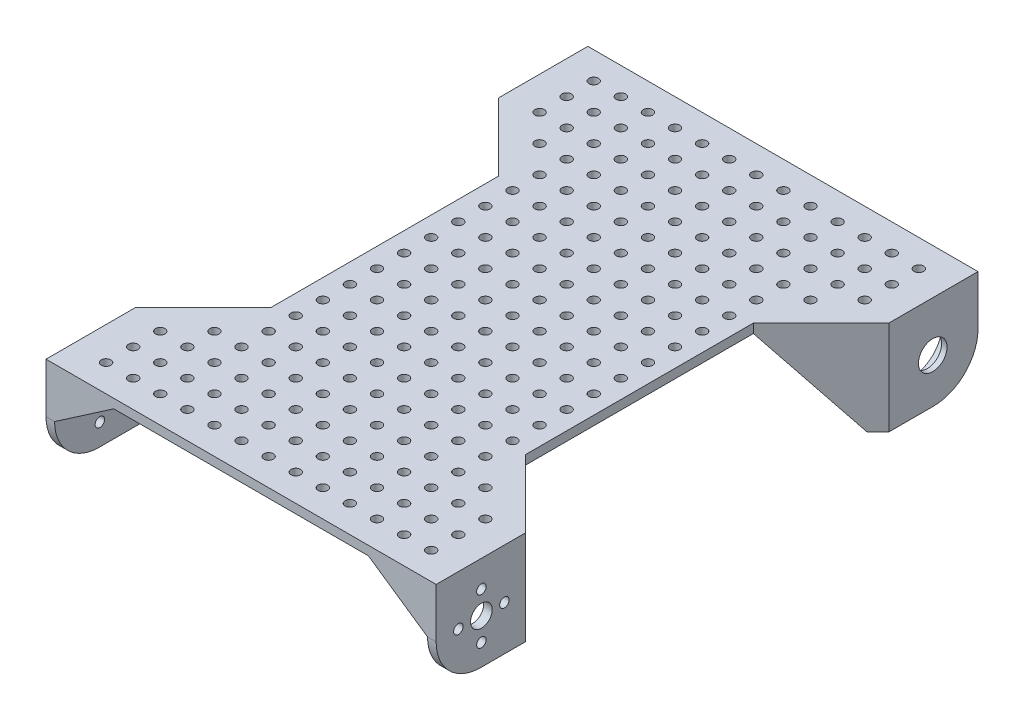
from build123d import *

# Parameters (mm, degrees)
CROQUIS1_R              = 1.75
CROQUIS1_R_2            = 4
CROQUIS1_R_3            = 5.275
SALIENTE_EXTRUIR1_DEPTH = 2
CROQUIS2_W              = 200
CROQUIS2_H              = 3.36816026
SALIENTE_EXTRUIR2_DEPTH = 70
CORTAR_EXTRUIR1_DEPTH   = 128.173513359
CROQUIS5_R              = 1.75
CROQUIS5_R_2            = 4
SALIENTE_EXTRUIR3_DEPTH = 1.175
CROQUIS6_R              = 11.25
SALIENTE_EXTRUIR4_DEPTH = 6.05
SALIENTE_EXTRUIR5_START = -3.175
SALIENTE_EXTRUIR5_DEPTH = 3.175
SALIENTE_EXTRUIR6_DEPTH = 4.875
SALIENTE_EXTRUIR7_DEPTH = 31.45
CORTAR_EXTRUIR2_DEPTH   = 147.040623629
CORTAR_EXTRUIR3_DEPTH   = 144.56214791
CROQUIS13_W             = 3
CROQUIS13_H             = 15
SALIENTE_EXTRUIR8_DEPTH = 21.825
CORTAR_EXTRUIR4_DEPTH   = 3
CORTAR_EXTRUIR5_DEPTH   = 3
CROQUIS16_R             = 1.75
CORTAR_EXTRUIR6_DEPTH   = 179.115419041


with BuildPart() as part:
    # Croquis1 → Saliente-Extruir1 (new body)
    with BuildSketch(Plane(origin=(0, 0, 0), x_dir=(0, 0, -1), z_dir=(1, 0, 0))):
        with BuildLine():
            Line((-67.1, 0), (67.1, 0))
            Line((67.1, 0), (67.1, -15))
            ThreePointArc((67.1, -15), (83.55, -31.45), (100, -15))
            Line((100, -15), (100, 0))
            Line((100, 0), (100, 3.36816026))
            Line((100, 3.36816026), (-100, 3.36816026))
            Line((-100, 3.36816026), (-100, 0))
            Line((-100, 0), (-100, -15))
            ThreePointArc((-100, -15), (-83.55, -31.45), (-67.1, -15))
            Line((-67.1, -15), (-67.1, 0))
        make_face()
        with Locations((-83.3, -23.5)):
            Circle(CROQUIS1_R, mode=Mode.SUBTRACT)
        with Locations((-91.8, -15)):
            Circle(CROQUIS1_R, mode=Mode.SUBTRACT)
        with Locations((-74.8, -15)):
            Circle(CROQUIS1_R, mode=Mode.SUBTRACT)
        with Locations((-83.3, -6.5)):
            Circle(CROQUIS1_R, mode=Mode.SUBTRACT)
        with Locations((-83.3, -15)):
            Circle(CROQUIS1_R_2, mode=Mode.SUBTRACT)
        with Locations((83.3, -15)):
            Circle(CROQUIS1_R_3, mode=Mode.SUBTRACT)
    extrude(amount=SALIENTE_EXTRUIR1_DEPTH)

    # Croquis2 → Saliente-Extruir2 (add)
    with BuildSketch(Plane(origin=(2, 0, 0), x_dir=(0, 0, -1), z_dir=(1, 0, 0))):
        with Locations((0, 1.68408013)):
            Rectangle(CROQUIS2_W, CROQUIS2_H)
    extrude(amount=SALIENTE_EXTRUIR2_DEPTH)

    # Croquis3 → Cortar-Extruir1 (cut, through all)
    with BuildSketch(Plane.XZ):
        Polygon((0, 67.1), (25, 42.1), (25, -42.1), (0, -67.1), align=None)
    extrude(amount=-CORTAR_EXTRUIR1_DEPTH, mode=Mode.SUBTRACT)

    # Croquis5 → Saliente-Extruir3 (add)
    with BuildSketch(Plane(origin=(2, 0, 0), x_dir=(0, 0, -1), z_dir=(1, 0, 0))):
        with BuildLine():
            Line((-67.1, 0), (-100, 0))
            Line((-100, 0), (-100, -15))
            ThreePointArc((-100, -15), (-83.55, -31.45), (-67.1, -15))
            Line((-67.1, -15), (-67.1, 0))
        make_face()
        with Locations((-83.3, -23.5)):
            Circle(CROQUIS5_R, mode=Mode.SUBTRACT)
        with Locations((-91.8, -15)):
            Circle(CROQUIS5_R, mode=Mode.SUBTRACT)
        with Locations((-74.8, -15)):
            Circle(CROQUIS5_R, mode=Mode.SUBTRACT)
        with Locations((-83.3, -6.5)):
            Circle(CROQUIS5_R, mode=Mode.SUBTRACT)
        with Locations((-83.3, -15)):
            Circle(CROQUIS5_R_2, mode=Mode.SUBTRACT)
    extrude(amount=SALIENTE_EXTRUIR3_DEPTH)

    # Croquis6 → Saliente-Extruir4 (add)
    with BuildSketch(Plane(origin=(2, 0, 0), x_dir=(0, 0, -1), z_dir=(1, 0, 0))):
        with BuildLine():
            Line((100, 0), (67.1, 0))
            Line((67.1, 0), (67.1, -15))
            ThreePointArc((67.1, -15), (83.55, -31.45), (100, -15))
            Line((100, -15), (100, 0))
        make_face()
        with Locations((83.55, -15)):
            Circle(CROQUIS6_R, mode=Mode.SUBTRACT)
    extrude(amount=SALIENTE_EXTRUIR4_DEPTH)

    # Croquis8 → Saliente-Extruir5 (add)
    with BuildSketch(Plane(origin=(3.175, 0, 0), x_dir=(0, 0, -1), z_dir=(1, 0, 0)).offset(SALIENTE_EXTRUIR5_START)):
        with BuildLine():
            Line((-83.55, -31.45), (-67.1, -31.45))
            Line((-67.1, -31.45), (-67.1, -15))
            ThreePointArc((-67.1, -15), (-71.918093449, -26.631906551), (-83.55, -31.45))
        make_face()
        with BuildLine():
            Line((83.55, -31.45), (67.1, -31.45))
            Line((67.1, -31.45), (67.1, -15))
            ThreePointArc((67.1, -15), (71.918093449, -26.631906551), (83.55, -31.45))
        make_face()
    extrude(amount=SALIENTE_EXTRUIR5_DEPTH)

    # Croquis10 → Saliente-Extruir6 (add)
    with BuildSketch(Plane(origin=(3.175, 0, 0), x_dir=(0, 0, -1), z_dir=(1, 0, 0))):
        with BuildLine():
            Line((67.1, -15), (67.1, -31.45))
            Line((67.1, -31.45), (83.55, -31.45))
            ThreePointArc((83.55, -31.45), (71.918093449, -26.631906551), (67.1, -15))
        make_face()
    extrude(amount=SALIENTE_EXTRUIR6_DEPTH)

    # Croquis9 → Saliente-Extruir7 (add)
    with BuildSketch(Plane.XZ):
        Polygon((25, 42.1), (25, 45.275), (3.175, 67.1), (0, 67.1), align=None)
        Polygon((25, -50.15), (8.05, -67.1), (0, -67.1), (25, -42.1), align=None)
    extrude(amount=SALIENTE_EXTRUIR7_DEPTH)

    # Croquis11 → Cortar-Extruir2 (cut, through all)
    with BuildSketch(Plane(origin=(37.575, 0, -37.575), x_dir=(-0.7071067811865475, 0, -0.7071067811865477), z_dir=(0.7071067811865477, 0, -0.7071067811865475))):
        Polygon((41.754655429, -31.45), (12.091525958, 0), (12.091525958, -31.45), align=None)
    extrude(amount=-CORTAR_EXTRUIR2_DEPTH, mode=Mode.SUBTRACT)

    # Croquis12 → Cortar-Extruir3 (cut, through all)
    with BuildSketch(Plane(origin=(35.1375, 0, 35.1375), x_dir=(0.7071067811865475, 0, -0.7071067811865477), z_dir=(0.7071067811865477, 0, 0.7071067811865475))):
        Polygon((-45.201800987, -31.45), (-12.091525958, 0), (-12.091525958, -31.45), align=None)
    extrude(amount=-CORTAR_EXTRUIR3_DEPTH, mode=Mode.SUBTRACT)

    # Croquis13 → Saliente-Extruir8 (add)
    with BuildSketch(Plane(origin=(3.175, 0, 0), x_dir=(0, 0, -1), z_dir=(1, 0, 0))):
        with Locations((-98.5, -7.5)):
            Rectangle(CROQUIS13_W, CROQUIS13_H)
        with Locations((98.5, -7.5)):
            Rectangle(CROQUIS13_W, CROQUIS13_H)
    extrude(amount=SALIENTE_EXTRUIR8_DEPTH)

    # Croquis14 → Cortar-Extruir4 (cut)
    with BuildSketch(Plane.XY.offset(100)):
        Polygon((3.175, -15), (25, 0), (25, -15), align=None)
    extrude(amount=-CORTAR_EXTRUIR4_DEPTH, mode=Mode.SUBTRACT)

    # Croquis15 → Cortar-Extruir5 (cut)
    with BuildSketch(Plane(origin=(0, 0, -100), x_dir=(-1, 0, 0), z_dir=(0, 0, -1))):
        Polygon((-8.05, -15), (-25, 0), (-25, -15), align=None)
    extrude(amount=-CORTAR_EXTRUIR5_DEPTH, mode=Mode.SUBTRACT)

    # Simetría1: part across plane


with BuildPart() as part_1:
    add(part.part)
    add(part.part.mirror(Plane(origin=(72, 0, 0), x_dir=(0, 0, 1), z_dir=(1, 0, 0))))

    # Croquis16 → Cortar-Extruir6 (cut, through all)
    with BuildSketch(Plane.XZ):
        with Locations(Location((12.175, 90, 0), (0, 0, 270))):
            Circle(CROQUIS16_R)
        with Locations(Location((22.175, 90, 0), (0, 0, 270))):
            Circle(CROQUIS16_R)
        with Locations(Location((32.175, 90, 0), (0, 0, 270))):
            Circle(CROQUIS16_R)
        with Locations(Location((42.175, 90, 0), (0, 0, 270))):
            Circle(CROQUIS16_R)
        with Locations(Location((52.175, 90, 0), (0, 0, 270))):
            Circle(CROQUIS16_R)
        with Locations(Location((62.175, 90, 0), (0, 0, 270))):
            Circle(CROQUIS16_R)
        with Locations(Location((72.175, 90, 0), (0, 0, 270))):
            Circle(CROQUIS16_R)
        with Locations(Location((82.175, 90, 0), (0, 0, 270))):
            Circle(CROQUIS16_R)
        with Locations(Location((92.175, 90, 0), (0, 0, 270))):
            Circle(CROQUIS16_R)
        with Locations(Location((102.175, 90, 0), (0, 0, 270))):
            Circle(CROQUIS16_R)
        with Locations(Location((112.175, 90, 0), (0, 0, 270))):
            Circle(CROQUIS16_R)
        with Locations(Location((122.175, 90, 0), (0, 0, 270))):
            Circle(CROQUIS16_R)
        with Locations(Location((132.175, 90, 0), (0, 0, 270))):
            Circle(CROQUIS16_R)
        with Locations(Location((22.175, 80, 0), (0, 0, 270))):
            Circle(CROQUIS16_R)
        with Locations(Location((32.175, 80, 0), (0, 0, 270))):
            Circle(CROQUIS16_R)
        with Locations(Location((42.175, 80, 0), (0, 0, 270))):
            Circle(CROQUIS16_R)
        with Locations(Location((52.175, 80, 0), (0, 0, 270))):
            Circle(CROQUIS16_R)
        with Locations(Location((62.175, 80, 0), (0, 0, 270))):
            Circle(CROQUIS16_R)
        with Locations(Location((72.175, 80, 0), (0, 0, 270))):
            Circle(CROQUIS16_R)
        with Locations(Location((82.175, 80, 0), (0, 0, 270))):
            Circle(CROQUIS16_R)
        with Locations(Location((92.175, 80, 0), (0, 0, 270))):
            Circle(CROQUIS16_R)
        with Locations(Location((102.175, 80, 0), (0, 0, 270))):
            Circle(CROQUIS16_R)
        with Locations(Location((112.175, 80, 0), (0, 0, 270))):
            Circle(CROQUIS16_R)
        with Locations(Location((122.175, 80, 0), (0, 0, 270))):
            Circle(CROQUIS16_R)
        with Locations(Location((132.175, 80, 0), (0, 0, 270))):
            Circle(CROQUIS16_R)
        with Locations(Location((22.175, 70, 0), (0, 0, 270))):
            Circle(CROQUIS16_R)
        with Locations(Location((32.175, 70, 0), (0, 0, 270))):
            Circle(CROQUIS16_R)
        with Locations(Location((42.175, 70, 0), (0, 0, 270))):
            Circle(CROQUIS16_R)
        with Locations(Location((52.175, 70, 0), (0, 0, 270))):
            Circle(CROQUIS16_R)
        with Locations(Location((62.175, 70, 0), (0, 0, 270))):
            Circle(CROQUIS16_R)
        with Locations(Location((72.175, 70, 0), (0, 0, 270))):
            Circle(CROQUIS16_R)
        with Locations(Location((82.175, 70, 0), (0, 0, 270))):
            Circle(CROQUIS16_R)
        with Locations(Location((92.175, 70, 0), (0, 0, 270))):
            Circle(CROQUIS16_R)
        with Locations(Location((102.175, 70, 0), (0, 0, 270))):
            Circle(CROQUIS16_R)
        with Locations(Location((112.175, 70, 0), (0, 0, 270))):
            Circle(CROQUIS16_R)
        with Locations(Location((122.175, 70, 0), (0, 0, 270))):
            Circle(CROQUIS16_R)
        with Locations(Location((132.175, 70, 0), (0, 0, 270))):
            Circle(CROQUIS16_R)
        with Locations(Location((22.175, 60, 0), (0, 0, 270))):
            Circle(CROQUIS16_R)
        with Locations(Location((32.175, 60, 0), (0, 0, 270))):
            Circle(CROQUIS16_R)
        with Locations(Location((42.175, 60, 0), (0, 0, 270))):
            Circle(CROQUIS16_R)
        with Locations(Location((52.175, 60, 0), (0, 0, 270))):
            Circle(CROQUIS16_R)
        with Locations(Location((62.175, 60, 0), (0, 0, 270))):
            Circle(CROQUIS16_R)
        with Locations(Location((72.175, 60, 0), (0, 0, 270))):
            Circle(CROQUIS16_R)
        with Locations(Location((82.175, 60, 0), (0, 0, 270))):
            Circle(CROQUIS16_R)
        with Locations(Location((92.175, 60, 0), (0, 0, 270))):
            Circle(CROQUIS16_R)
        with Locations(Location((102.175, 60, 0), (0, 0, 270))):
            Circle(CROQUIS16_R)
        with Locations(Location((112.175, 60, 0), (0, 0, 270))):
            Circle(CROQUIS16_R)
        with Locations(Location((122.175, 60, 0), (0, 0, 270))):
            Circle(CROQUIS16_R)
        with Locations(Location((32.175, 50, 0), (0, 0, 270))):
            Circle(CROQUIS16_R)
        with Locations(Location((42.175, 50, 0), (0, 0, 270))):
            Circle(CROQUIS16_R)
        with Locations(Location((52.175, 50, 0), (0, 0, 270))):
            Circle(CROQUIS16_R)
        with Locations(Location((62.175, 50, 0), (0, 0, 270))):
            Circle(CROQUIS16_R)
        with Locations(Location((72.175, 50, 0), (0, 0, 270))):
            Circle(CROQUIS16_R)
        with Locations(Location((82.175, 50, 0), (0, 0, 270))):
            Circle(CROQUIS16_R)
        with Locations(Location((92.175, 50, 0), (0, 0, 270))):
            Circle(CROQUIS16_R)
        with Locations(Location((102.175, 50, 0), (0, 0, 270))):
            Circle(CROQUIS16_R)
        with Locations(Location((112.175, 50, 0), (0, 0, 270))):
            Circle(CROQUIS16_R)
        with Locations(Location((32.175, 40, 0), (0, 0, 270))):
            Circle(CROQUIS16_R)
        with Locations(Location((42.175, 40, 0), (0, 0, 270))):
            Circle(CROQUIS16_R)
        with Locations(Location((52.175, 40, 0), (0, 0, 270))):
            Circle(CROQUIS16_R)
        with Locations(Location((62.175, 40, 0), (0, 0, 270))):
            Circle(CROQUIS16_R)
        with Locations(Location((72.175, 40, 0), (0, 0, 270))):
            Circle(CROQUIS16_R)
        with Locations(Location((82.175, 40, 0), (0, 0, 270))):
            Circle(CROQUIS16_R)
        with Locations(Location((92.175, 40, 0), (0, 0, 270))):
            Circle(CROQUIS16_R)
        with Locations(Location((102.175, 40, 0), (0, 0, 270))):
            Circle(CROQUIS16_R)
        with Locations(Location((112.175, 40, 0), (0, 0, 270))):
            Circle(CROQUIS16_R)
        with Locations(Location((32.175, 30, 0), (0, 0, 270))):
            Circle(CROQUIS16_R)
        with Locations(Location((42.175, 30, 0), (0, 0, 270))):
            Circle(CROQUIS16_R)
        with Locations(Location((52.175, 30, 0), (0, 0, 270))):
            Circle(CROQUIS16_R)
        with Locations(Location((62.175, 30, 0), (0, 0, 270))):
            Circle(CROQUIS16_R)
        with Locations(Location((72.175, 30, 0), (0, 0, 270))):
            Circle(CROQUIS16_R)
        with Locations(Location((82.175, 30, 0), (0, 0, 270))):
            Circle(CROQUIS16_R)
        with Locations(Location((92.175, 30, 0), (0, 0, 270))):
            Circle(CROQUIS16_R)
        with Locations(Location((102.175, 30, 0), (0, 0, 270))):
            Circle(CROQUIS16_R)
        with Locations(Location((112.175, 30, 0), (0, 0, 270))):
            Circle(CROQUIS16_R)
        with Locations(Location((32.175, 20, 0), (0, 0, 270))):
            Circle(CROQUIS16_R)
        with Locations(Location((42.175, 20, 0), (0, 0, 270))):
            Circle(CROQUIS16_R)
        with Locations(Location((52.175, 20, 0), (0, 0, 270))):
            Circle(CROQUIS16_R)
        with Locations(Location((62.175, 20, 0), (0, 0, 270))):
            Circle(CROQUIS16_R)
        with Locations(Location((72.175, 20, 0), (0, 0, 270))):
            Circle(CROQUIS16_R)
        with Locations(Location((82.175, 20, 0), (0, 0, 270))):
            Circle(CROQUIS16_R)
        with Locations(Location((92.175, 20, 0), (0, 0, 270))):
            Circle(CROQUIS16_R)
        with Locations(Location((102.175, 20, 0), (0, 0, 270))):
            Circle(CROQUIS16_R)
        with Locations(Location((112.175, 20, 0), (0, 0, 270))):
            Circle(CROQUIS16_R)
        with Locations(Location((32.175, 10, 0), (0, 0, 270))):
            Circle(CROQUIS16_R)
        with Locations(Location((42.175, 10, 0), (0, 0, 270))):
            Circle(CROQUIS16_R)
        with Locations(Location((52.175, 10, 0), (0, 0, 270))):
            Circle(CROQUIS16_R)
        with Locations(Location((62.175, 10, 0), (0, 0, 270))):
            Circle(CROQUIS16_R)
        with Locations(Location((72.175, 10, 0), (0, 0, 270))):
            Circle(CROQUIS16_R)
        with Locations(Location((82.175, 10, 0), (0, 0, 270))):
            Circle(CROQUIS16_R)
        with Locations(Location((92.175, 10, 0), (0, 0, 270))):
            Circle(CROQUIS16_R)
        with Locations(Location((102.175, 10, 0), (0, 0, 270))):
            Circle(CROQUIS16_R)
        with Locations(Location((112.175, 10, 0), (0, 0, 270))):
            Circle(CROQUIS16_R)
        with Locations(Location((32.175, 0, 0), (0, 0, 270))):
            Circle(CROQUIS16_R)
        with Locations(Location((42.175, 0, 0), (0, 0, 270))):
            Circle(CROQUIS16_R)
        with Locations(Location((52.175, 0, 0), (0, 0, 270))):
            Circle(CROQUIS16_R)
        with Locations(Location((62.175, 0, 0), (0, 0, 270))):
            Circle(CROQUIS16_R)
        with Locations(Location((72.175, 0, 0), (0, 0, 270))):
            Circle(CROQUIS16_R)
        with Locations(Location((82.175, 0, 0), (0, 0, 270))):
            Circle(CROQUIS16_R)
        with Locations(Location((92.175, 0, 0), (0, 0, 270))):
            Circle(CROQUIS16_R)
        with Locations(Location((102.175, 0, 0), (0, 0, 270))):
            Circle(CROQUIS16_R)
        with Locations(Location((112.175, 0, 0), (0, 0, 270))):
            Circle(CROQUIS16_R)
        with Locations(Location((32.175, -10, 0), (0, 0, 270))):
            Circle(CROQUIS16_R)
        with Locations(Location((42.175, -10, 0), (0, 0, 270))):
            Circle(CROQUIS16_R)
        with Locations(Location((52.175, -10, 0), (0, 0, 270))):
            Circle(CROQUIS16_R)
        with Locations(Location((62.175, -10, 0), (0, 0, 270))):
            Circle(CROQUIS16_R)
        with Locations(Location((72.175, -10, 0), (0, 0, 270))):
            Circle(CROQUIS16_R)
        with Locations(Location((82.175, -10, 0), (0, 0, 270))):
            Circle(CROQUIS16_R)
        with Locations(Location((92.175, -10, 0), (0, 0, 270))):
            Circle(CROQUIS16_R)
        with Locations(Location((102.175, -10, 0), (0, 0, 270))):
            Circle(CROQUIS16_R)
        with Locations(Location((112.175, -10, 0), (0, 0, 270))):
            Circle(CROQUIS16_R)
        with Locations(Location((32.175, -20, 0), (0, 0, 270))):
            Circle(CROQUIS16_R)
        with Locations(Location((42.175, -20, 0), (0, 0, 270))):
            Circle(CROQUIS16_R)
        with Locations(Location((52.175, -20, 0), (0, 0, 270))):
            Circle(CROQUIS16_R)
        with Locations(Location((62.175, -20, 0), (0, 0, 270))):
            Circle(CROQUIS16_R)
        with Locations(Location((72.175, -20, 0), (0, 0, 270))):
            Circle(CROQUIS16_R)
        with Locations(Location((82.175, -20, 0), (0, 0, 270))):
            Circle(CROQUIS16_R)
        with Locations(Location((92.175, -20, 0), (0, 0, 270))):
            Circle(CROQUIS16_R)
        with Locations(Location((102.175, -20, 0), (0, 0, 270))):
            Circle(CROQUIS16_R)
        with Locations(Location((112.175, -20, 0), (0, 0, 270))):
            Circle(CROQUIS16_R)
        with Locations(Location((32.175, -30, 0), (0, 0, 270))):
            Circle(CROQUIS16_R)
        with Locations(Location((42.175, -30, 0), (0, 0, 270))):
            Circle(CROQUIS16_R)
        with Locations(Location((52.175, -30, 0), (0, 0, 270))):
            Circle(CROQUIS16_R)
        with Locations(Location((62.175, -30, 0), (0, 0, 270))):
            Circle(CROQUIS16_R)
        with Locations(Location((72.175, -30, 0), (0, 0, 270))):
            Circle(CROQUIS16_R)
        with Locations(Location((82.175, -30, 0), (0, 0, 270))):
            Circle(CROQUIS16_R)
        with Locations(Location((92.175, -30, 0), (0, 0, 270))):
            Circle(CROQUIS16_R)
        with Locations(Location((102.175, -30, 0), (0, 0, 270))):
            Circle(CROQUIS16_R)
        with Locations(Location((112.175, -30, 0), (0, 0, 270))):
            Circle(CROQUIS16_R)
        with Locations(Location((32.175, -40, 0), (0, 0, 270))):
            Circle(CROQUIS16_R)
        with Locations(Location((42.175, -40, 0), (0, 0, 270))):
            Circle(CROQUIS16_R)
        with Locations(Location((52.175, -40, 0), (0, 0, 270))):
            Circle(CROQUIS16_R)
        with Locations(Location((62.175, -40, 0), (0, 0, 270))):
            Circle(CROQUIS16_R)
        with Locations(Location((72.175, -40, 0), (0, 0, 270))):
            Circle(CROQUIS16_R)
        with Locations(Location((82.175, -40, 0), (0, 0, 270))):
            Circle(CROQUIS16_R)
        with Locations(Location((92.175, -40, 0), (0, 0, 270))):
            Circle(CROQUIS16_R)
        with Locations(Location((102.175, -40, 0), (0, 0, 270))):
            Circle(CROQUIS16_R)
        with Locations(Location((112.175, -40, 0), (0, 0, 270))):
            Circle(CROQUIS16_R)
        with Locations(Location((32.175, -50, 0), (0, 0, 270))):
            Circle(CROQUIS16_R)
        with Locations(Location((42.175, -50, 0), (0, 0, 270))):
            Circle(CROQUIS16_R)
        with Locations(Location((52.175, -50, 0), (0, 0, 270))):
            Circle(CROQUIS16_R)
        with Locations(Location((62.175, -50, 0), (0, 0, 270))):
            Circle(CROQUIS16_R)
        with Locations(Location((72.175, -50, 0), (0, 0, 270))):
            Circle(CROQUIS16_R)
        with Locations(Location((82.175, -50, 0), (0, 0, 270))):
            Circle(CROQUIS16_R)
        with Locations(Location((92.175, -50, 0), (0, 0, 270))):
            Circle(CROQUIS16_R)
        with Locations(Location((102.175, -50, 0), (0, 0, 270))):
            Circle(CROQUIS16_R)
        with Locations(Location((112.175, -50, 0), (0, 0, 270))):
            Circle(CROQUIS16_R)
        with Locations(Location((22.175, -60, 0), (0, 0, 270))):
            Circle(CROQUIS16_R)
        with Locations(Location((32.175, -60, 0), (0, 0, 270))):
            Circle(CROQUIS16_R)
        with Locations(Location((42.175, -60, 0), (0, 0, 270))):
            Circle(CROQUIS16_R)
        with Locations(Location((52.175, -60, 0), (0, 0, 270))):
            Circle(CROQUIS16_R)
        with Locations(Location((62.175, -60, 0), (0, 0, 270))):
            Circle(CROQUIS16_R)
        with Locations(Location((72.175, -60, 0), (0, 0, 270))):
            Circle(CROQUIS16_R)
        with Locations(Location((82.175, -60, 0), (0, 0, 270))):
            Circle(CROQUIS16_R)
        with Locations(Location((92.175, -60, 0), (0, 0, 270))):
            Circle(CROQUIS16_R)
        with Locations(Location((102.175, -60, 0), (0, 0, 270))):
            Circle(CROQUIS16_R)
        with Locations(Location((112.175, -60, 0), (0, 0, 270))):
            Circle(CROQUIS16_R)
        with Locations(Location((122.175, -60, 0), (0, 0, 270))):
            Circle(CROQUIS16_R)
        with Locations(Location((22.175, -70, 0), (0, 0, 270))):
            Circle(CROQUIS16_R)
        with Locations(Location((32.175, -70, 0), (0, 0, 270))):
            Circle(CROQUIS16_R)
        with Locations(Location((42.175, -70, 0), (0, 0, 270))):
            Circle(CROQUIS16_R)
        with Locations(Location((52.175, -70, 0), (0, 0, 270))):
            Circle(CROQUIS16_R)
        with Locations(Location((62.175, -70, 0), (0, 0, 270))):
            Circle(CROQUIS16_R)
        with Locations(Location((72.175, -70, 0), (0, 0, 270))):
            Circle(CROQUIS16_R)
        with Locations(Location((82.175, -70, 0), (0, 0, 270))):
            Circle(CROQUIS16_R)
        with Locations(Location((92.175, -70, 0), (0, 0, 270))):
            Circle(CROQUIS16_R)
        with Locations(Location((102.175, -70, 0), (0, 0, 270))):
            Circle(CROQUIS16_R)
        with Locations(Location((112.175, -70, 0), (0, 0, 270))):
            Circle(CROQUIS16_R)
        with Locations(Location((122.175, -70, 0), (0, 0, 270))):
            Circle(CROQUIS16_R)
        with Locations(Location((132.175, -70, 0), (0, 0, 270))):
            Circle(CROQUIS16_R)
        with Locations(Location((22.175, -80, 0), (0, 0, 270))):
            Circle(CROQUIS16_R)
        with Locations(Location((32.175, -80, 0), (0, 0, 270))):
            Circle(CROQUIS16_R)
        with Locations(Location((42.175, -80, 0), (0, 0, 270))):
            Circle(CROQUIS16_R)
        with Locations(Location((52.175, -80, 0), (0, 0, 270))):
            Circle(CROQUIS16_R)
        with Locations(Location((62.175, -80, 0), (0, 0, 270))):
            Circle(CROQUIS16_R)
        with Locations(Location((72.175, -80, 0), (0, 0, 270))):
            Circle(CROQUIS16_R)
        with Locations(Location((82.175, -80, 0), (0, 0, 270))):
            Circle(CROQUIS16_R)
        with Locations(Location((92.175, -80, 0), (0, 0, 270))):
            Circle(CROQUIS16_R)
        with Locations(Location((102.175, -80, 0), (0, 0, 270))):
            Circle(CROQUIS16_R)
        with Locations(Location((112.175, -80, 0), (0, 0, 270))):
            Circle(CROQUIS16_R)
        with Locations(Location((122.175, -80, 0), (0, 0, 270))):
            Circle(CROQUIS16_R)
        with Locations(Location((132.175, -80, 0), (0, 0, 270))):
            Circle(CROQUIS16_R)
        with Locations(Location((22.175, -90, 0), (0, 0, 270))):
            Circle(CROQUIS16_R)
        with Locations(Location((32.175, -90, 0), (0, 0, 270))):
            Circle(CROQUIS16_R)
        with Locations(Location((42.175, -90, 0), (0, 0, 270))):
            Circle(CROQUIS16_R)
        with Locations(Location((52.175, -90, 0), (0, 0, 270))):
            Circle(CROQUIS16_R)
        with Locations(Location((62.175, -90, 0), (0, 0, 270))):
            Circle(CROQUIS16_R)
        with Locations(Location((72.175, -90, 0), (0, 0, 270))):
            Circle(CROQUIS16_R)
        with Locations(Location((82.175, -90, 0), (0, 0, 270))):
            Circle(CROQUIS16_R)
        with Locations(Location((92.175, -90, 0), (0, 0, 270))):
            Circle(CROQUIS16_R)
        with Locations(Location((102.175, -90, 0), (0, 0, 270))):
            Circle(CROQUIS16_R)
        with Locations(Location((112.175, -90, 0), (0, 0, 270))):
            Circle(CROQUIS16_R)
        with Locations(Location((122.175, -90, 0), (0, 0, 270))):
            Circle(CROQUIS16_R)
        with Locations(Location((132.175, -90, 0), (0, 0, 270))):
            Circle(CROQUIS16_R)
        with Locations(Location((12.175, 80, 0), (0, 0, 270))):
            Circle(CROQUIS16_R)
        with Locations(Location((12.175, 70, 0), (0, 0, 270))):
            Circle(CROQUIS16_R)
        with Locations(Location((12.175, -70, 0), (0, 0, 270))):
            Circle(CROQUIS16_R)
        with Locations(Location((12.175, -80, 0), (0, 0, 270))):
            Circle(CROQUIS16_R)
        with Locations(Location((12.175, -90, 0), (0, 0, 270))):
            Circle(CROQUIS16_R)
    extrude(amount=-CORTAR_EXTRUIR6_DEPTH, mode=Mode.SUBTRACT)


solid = part_1.part
